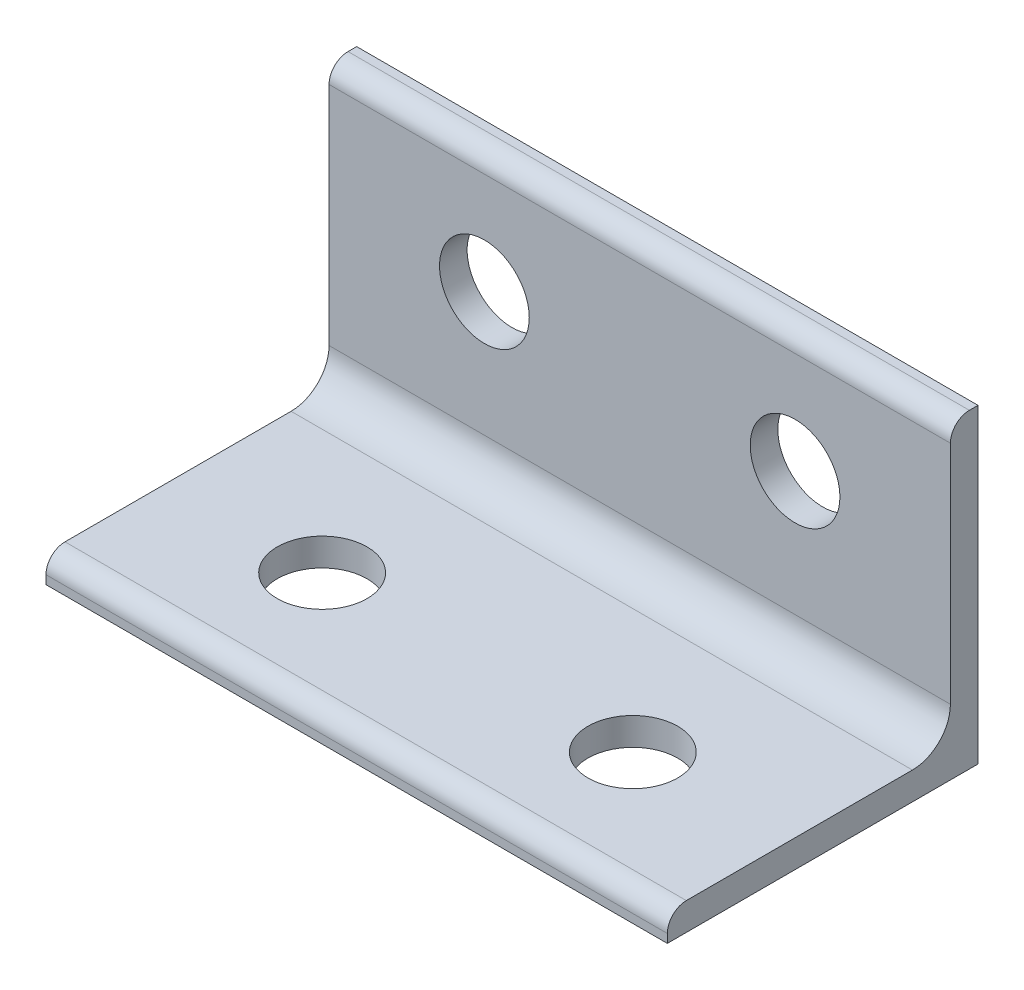
from build123d import *

# Parameters (mm, degrees)
ANGLES_EQUAL_90_X_90_X_8_1_DEPTH = 180
SKETCH12_R                       = 13
CUT_EXTRUDE1_DEPTH               = 221.45407685
LPATTERN1_COUNT                  = 2
LPATTERN1_PITCH                  = 90
CUT_EXTRUDE2_REACH               = 219.311
SKETCH13_R                       = 13
LPATTERN2_COUNT                  = 2
LPATTERN2_PITCH                  = 90


with BuildPart() as part:
    # Sketch11 → Angles equal 90 X 90 X 8(1) (new body)
    with BuildSketch(Plane(origin=(0, 45, 45), x_dir=(0, 1, 0), z_dir=(1, 0, 0))):
        with BuildLine():
            Line((-45, 45), (-45, -45))
            Line((-45, -45), (45, -45))
            Line((45, -45), (45, -42.5))
            ThreePointArc((45, -42.5), (43.389087297, -38.610912703), (39.5, -37))
            Line((39.5, -37), (-26, -37))
            ThreePointArc((-26, -37), (-33.778174593, -33.778174593), (-37, -26))
            Line((-37, -26), (-37, 39.5))
            ThreePointArc((-37, 39.5), (-38.610912703, 43.389087297), (-42.5, 45))
            Line((-42.5, 45), (-45, 45))
        make_face()
    extrude(amount=ANGLES_EQUAL_90_X_90_X_8_1_DEPTH)

    # Sketch12 → Cut-Extrude1 (cut, symmetric)
    with BuildSketch(Plane(origin=(0, 0, 0), x_dir=(1, 0, 0), z_dir=(0, 1, 0))):
        with Locations(Location((45, -55, 0), (0, 0, 90))):
            Circle(SKETCH12_R)
    cut_extrude1 = extrude(amount=CUT_EXTRUDE1_DEPTH, both=True, mode=Mode.SUBTRACT)

    # LPattern1: Cut-Extrude1 ×2
    with Locations(*[(i * LPATTERN1_PITCH, 0, 0) for i in range(1, LPATTERN1_COUNT)]):
        add(cut_extrude1, mode=Mode.SUBTRACT)

    # Sketch13 → Cut-Extrude2 (cut, up to next)
    with BuildSketch(Plane.XY.offset(8), mode=Mode.PRIVATE) as cut_extrude2_sk1:
        with Locations((45, 55)):
            Circle(SKETCH13_R)
    cut_extrude2_tool1 = extrude(cut_extrude2_sk1.sketch, amount=-CUT_EXTRUDE2_REACH, mode=Mode.PRIVATE) & part.part
    cut_extrude2 = cut_extrude2_tool1.solids().sort_by_distance((45, 55, 8))[0]
    add(cut_extrude2, mode=Mode.SUBTRACT)

    # LPattern2: Cut-Extrude2 ×2
    with Locations(*[(i * LPATTERN2_PITCH, 0, 0) for i in range(1, LPATTERN2_COUNT)]):
        add(cut_extrude2, mode=Mode.SUBTRACT)


solid = part.part
